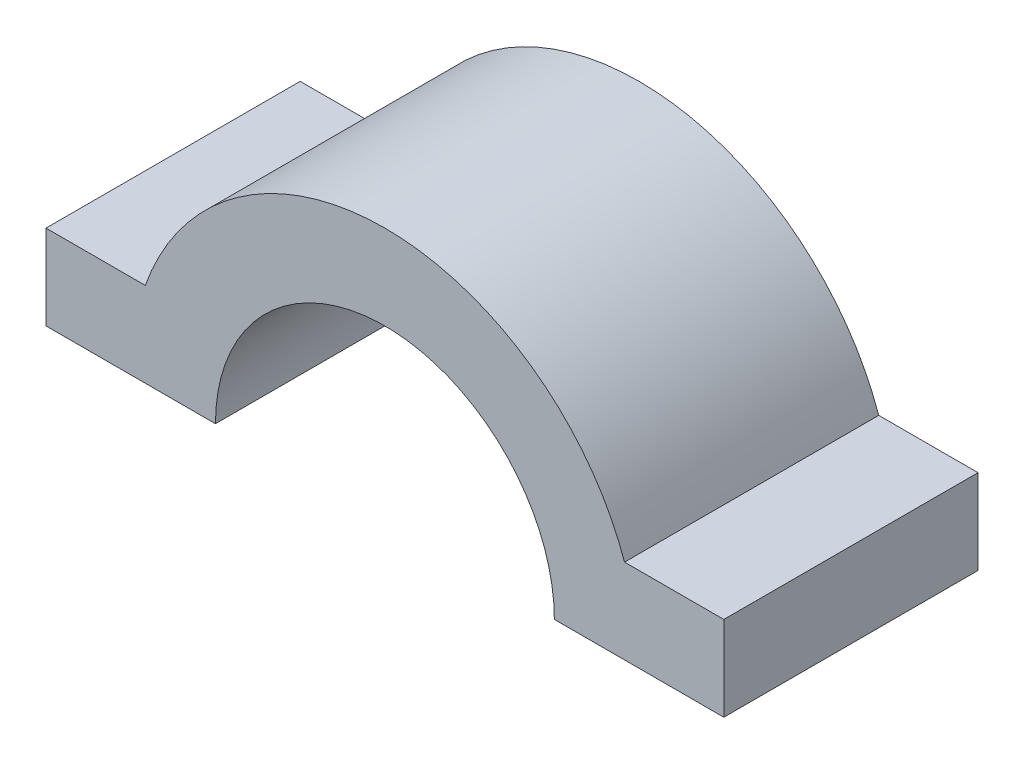
from build123d import *

# Parameters (mm, degrees)
SALIENTE_EXTRUIR1_DEPTH = 15


with BuildPart() as part:
    # Croquis1 → Saliente-Extruir1 (new body)
    with BuildSketch(Plane.XY):
        with BuildLine():
            Line((10, 0), (20, 0))
            Line((20, 0), (20, 5))
            Line((20, 5), (14.142135624, 5))
            ThreePointArc((14.142135624, 5), (0, 15), (-14.142135624, 5))
            Line((-14.142135624, 5), (-20, 5))
            Line((-20, 5), (-20, 0))
            Line((-20, 0), (-10, 0))
            ThreePointArc((-10, 0), (0, 10), (10, 0))
        make_face()
    extrude(amount=-SALIENTE_EXTRUIR1_DEPTH)


solid = part.part
